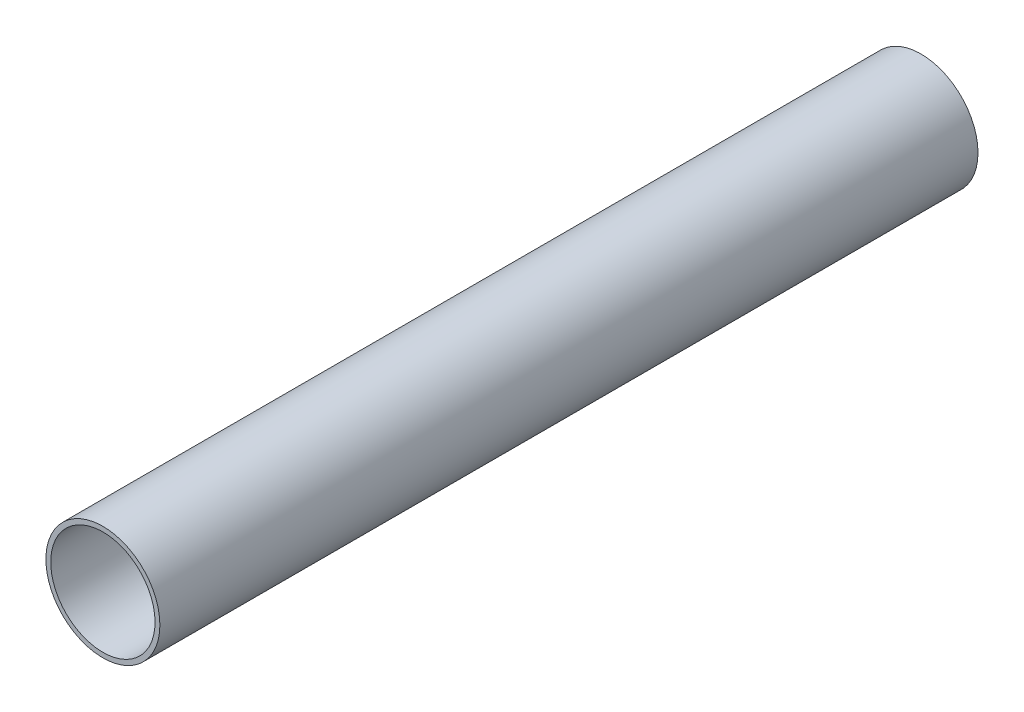
from build123d import *

# Parameters (mm, degrees)
SKETCH1_R           = 10.45
SKETCH1_R_2         = 9.565
BOSS_EXTRUDE1_DEPTH = 150


with BuildPart() as part:
    # Sketch1 → Boss-Extrude1 (new body)
    with BuildSketch(Plane.XY):
        Circle(SKETCH1_R)
        Circle(SKETCH1_R_2, mode=Mode.SUBTRACT)
    extrude(amount=BOSS_EXTRUDE1_DEPTH)


solid = part.part
